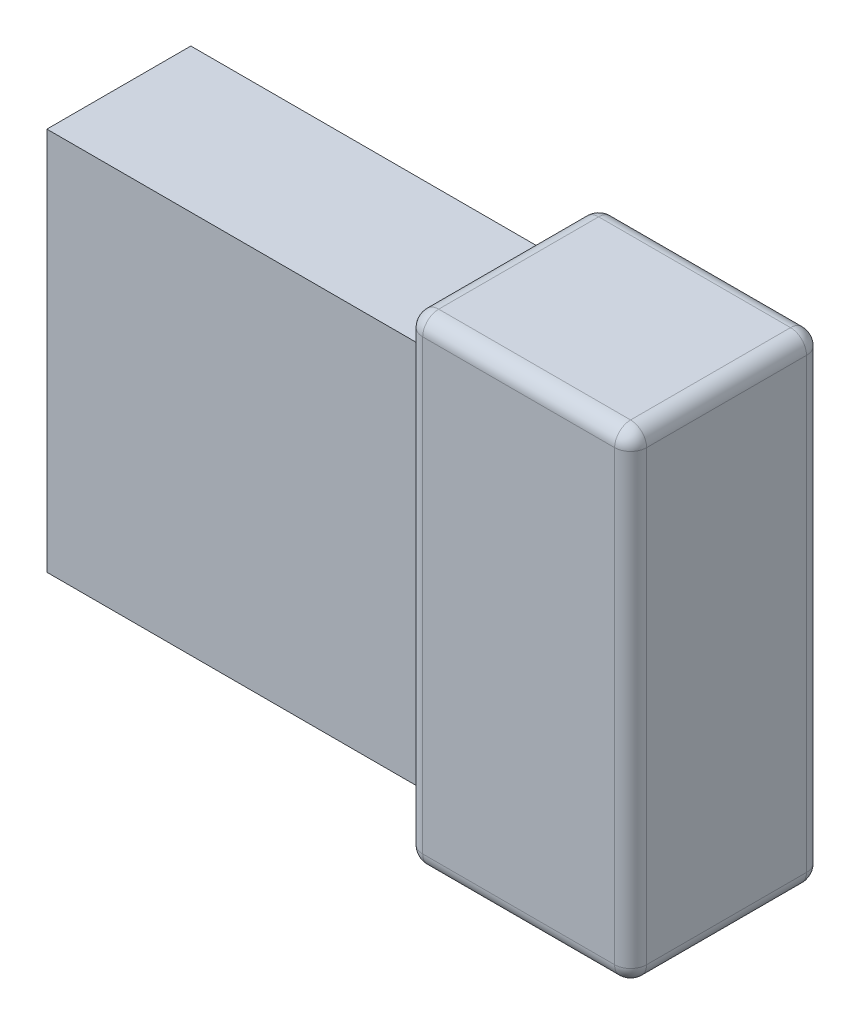
from build123d import *

# Parameters (mm, degrees)
SKETCH1_W           = 12
SKETCH1_H           = 12
BOSS_EXTRUDE1_DEPTH = 2.25
SKETCH1_3_W         = 7
SKETCH1_3_H         = 15
BOSS_EXTRUDE2_DEPTH = 3
FILLET1_R           = 0.5


with BuildPart() as part:
    # Sketch1 → Boss-Extrude1 (new, symmetric)
    with BuildSketch(Plane.XY):
        Rectangle(SKETCH1_W, SKETCH1_H)
    extrude(amount=BOSS_EXTRUDE1_DEPTH, both=True)

    # Sketch1<3> → Boss-Extrude2 (add, symmetric)
    with BuildSketch(Plane.XY):
        with Locations((9.5, 0)):
            Rectangle(SKETCH1_3_W, SKETCH1_3_H)
    extrude(amount=BOSS_EXTRUDE2_DEPTH, both=True)

    # Fillet1
    fillet1_edges = [part.edges().sort_by_distance(p)[0] for p in [
        (6, 0, 3),
        (13, 0, 3),
        (6, -7.5, 0),
        (9.5, -7.5, 3),
        (13, -7.5, 0),
        (6, 0, -3),
        (9.5, -7.5, -3),
        (13, 0, -3),
        (13, 7.5, 0),
        (9.5, 7.5, 3),
        (6, 7.5, 0),
        (9.5, 7.5, -3),
    ]]
    fillet(fillet1_edges, radius=FILLET1_R)


solid = part.part
